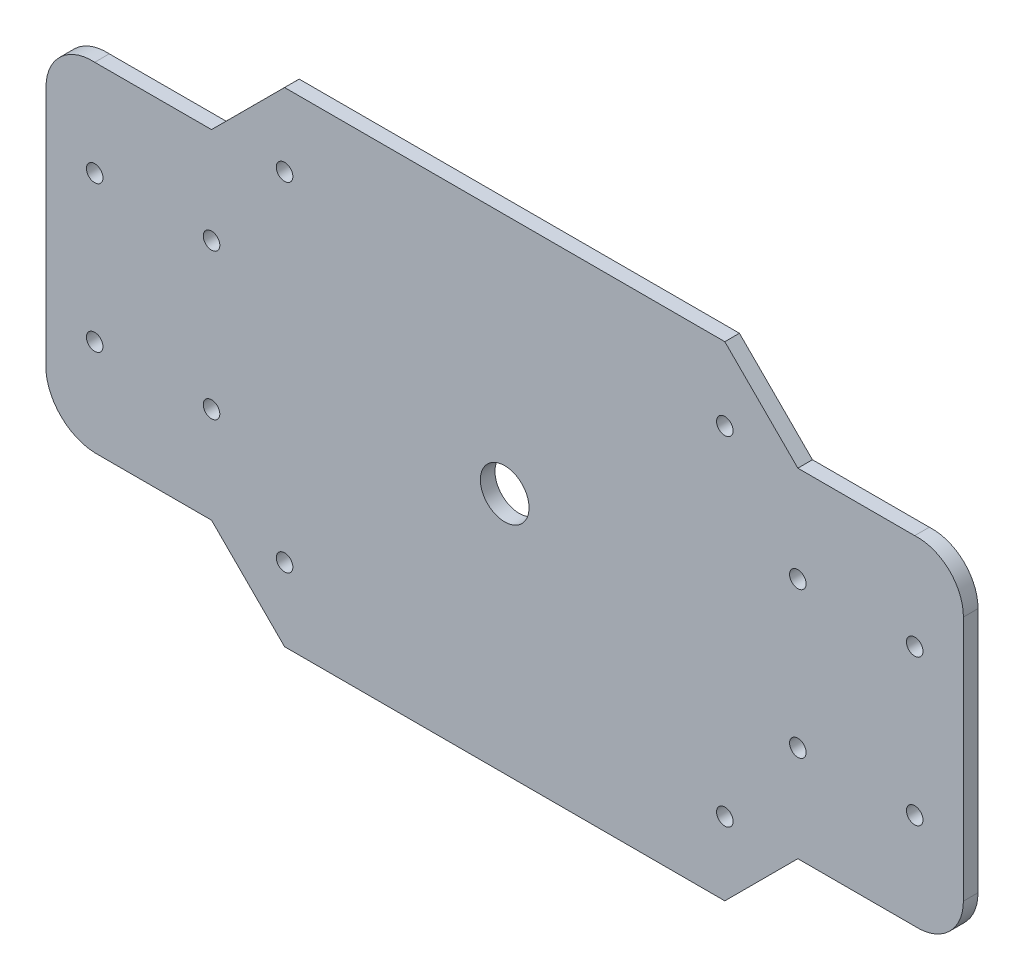
from build123d import *

# Parameters (mm, degrees)
SKETCH2_R           = 1.7
SKETCH2_R_2         = 5
BOSS_EXTRUDE4_DEPTH = 3


with BuildPart() as part:
    # Sketch2 → Boss-Extrude4 (new body)
    with BuildSketch(Plane.XY):
        with BuildLine():
            Line((-49.411099801, -41.712890537), (-34.411099801, -26.724072871))
            Line((-34.411099801, -26.724072871), (56.012900199, -26.724072871))
            Line((56.012900199, -26.724072871), (71.012900199, -41.724072871))
            Line((71.012900199, -41.724072871), (95.012900199, -41.724072871))
            ThreePointArc((95.012900199, -41.724072871), (102.06743807, -44.301892558), (105.013826091, -51.210615779))
            Line((105.013826091, -51.210615779), (105.009259778, -101.753736116))
            ThreePointArc((105.009259778, -101.753736116), (102.047198601, -108.629676096), (95.012900199, -111.193072871))
            Line((95.012900199, -111.193072871), (71.012900199, -111.193072871))
            Line((71.012900199, -111.193072871), (56.012900199, -126.193072871))
            Line((56.012900199, -126.193072871), (-34.411099801, -126.193072871))
            Line((-34.411099801, -126.193072871), (-49.411099801, -111.193072871))
            Line((-49.411099801, -111.193072871), (-73.411099801, -111.193072871))
            ThreePointArc((-73.411099801, -111.193072871), (-80.170723963, -108.333415965), (-83.411099801, -101.747816457))
            Line((-83.411099801, -101.747816457), (-83.411099801, -51.162112892))
            ThreePointArc((-83.411099801, -51.162112892), (-80.443251923, -44.29297937), (-73.411099801, -41.735255206))
            Line((-73.411099801, -41.735255206), (-49.411099801, -41.712890537))
        make_face()
        with Locations((-49.411099801, -61.458572871)):
            Circle(SKETCH2_R, mode=Mode.SUBTRACT)
        with Locations((-73.411099801, -61.458572871)):
            Circle(SKETCH2_R, mode=Mode.SUBTRACT)
        with Locations((-73.411099801, -91.458572871)):
            Circle(SKETCH2_R, mode=Mode.SUBTRACT)
        with Locations((-49.411099801, -91.458572871)):
            Circle(SKETCH2_R, mode=Mode.SUBTRACT)
        with Locations((95.012900199, -91.458572871)):
            Circle(SKETCH2_R, mode=Mode.SUBTRACT)
        with Locations((71.012900199, -91.458572871)):
            Circle(SKETCH2_R, mode=Mode.SUBTRACT)
        with Locations((95.012900199, -61.458572871)):
            Circle(SKETCH2_R, mode=Mode.SUBTRACT)
        with Locations((71.012900199, -61.458572871)):
            Circle(SKETCH2_R, mode=Mode.SUBTRACT)
        with Locations((10.800900199, -76.383042082)):
            Circle(SKETCH2_R_2, mode=Mode.SUBTRACT)
        with Locations((-34.411099801, -41.724072871)):
            Circle(SKETCH2_R, mode=Mode.SUBTRACT)
        with Locations((-34.411099801, -111.193072871)):
            Circle(SKETCH2_R, mode=Mode.SUBTRACT)
        with Locations((56.012900199, -111.193072871)):
            Circle(SKETCH2_R, mode=Mode.SUBTRACT)
        with Locations((56.012900199, -41.724072871)):
            Circle(SKETCH2_R, mode=Mode.SUBTRACT)
    extrude(amount=BOSS_EXTRUDE4_DEPTH)


solid = part.part
